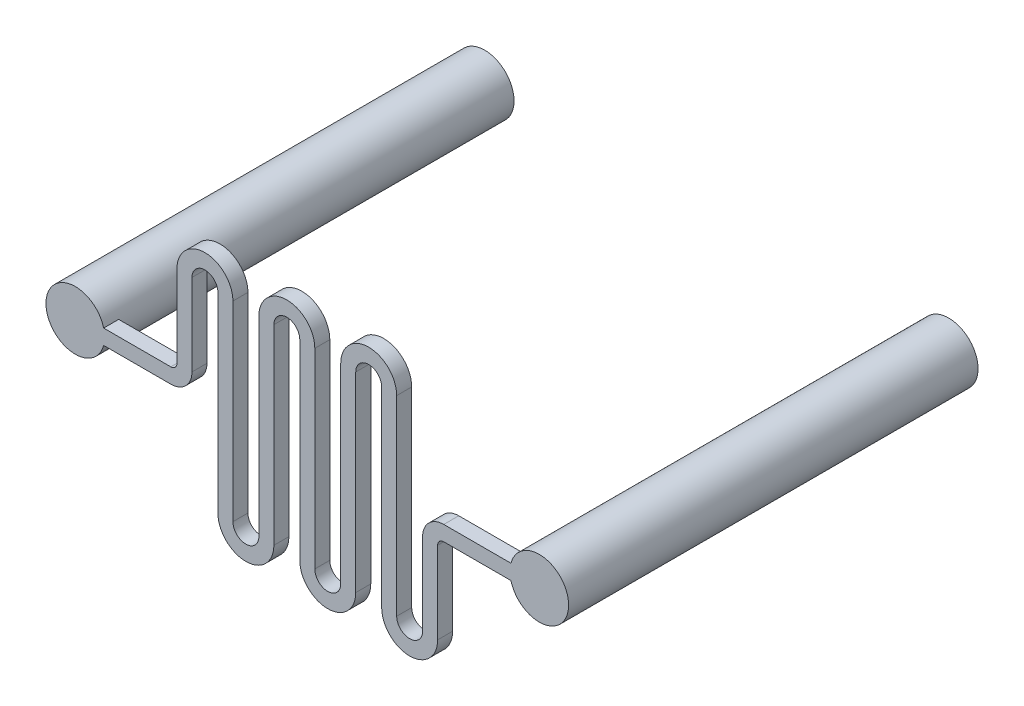
from build123d import *

# Parameters (mm, degrees)
BOSS_EXTRUDE1_DEPTH = 1.1
SKETCH3_W           = 2.15
SKETCH3_H           = 30
SKETCH4_W           = 2.15
SKETCH4_H           = 30
SKETCH5_R           = 1.5
CUT_EXTRUDE1_DEPTH  = 28


with BuildPart() as part:
    # Sketch2 → Boss-Extrude1 (new body)
    with BuildSketch(Plane.XY):
        with BuildLine():
            Line((-20.5, -0.55), (-13.5, -0.55))
            ThreePointArc((-13.5, -0.55), (-12.403984489, -0.096015511), (-11.95, 1))
            Line((-11.95, 1), (-11.95, 7))
            ThreePointArc((-11.95, 7), (-11, 7.95), (-10.05, 7))
            Line((-10.05, 7), (-10.05, 0))
            Line((-10.05, 0), (-10.05, -7))
            ThreePointArc((-10.05, -7), (-8, -9.05), (-5.95, -7))
            Line((-5.95, -7), (-5.95, 0))
            Line((-5.95, 0), (-5.95, 7))
            ThreePointArc((-5.95, 7), (-5, 7.95), (-4.05, 7))
            Line((-4.05, 7), (-4.05, 0))
            Line((-4.05, 0), (-4.05, -7))
            ThreePointArc((-4.05, -7), (-2, -9.05), (0.05, -7))
            Line((0.05, -7), (0.05, 0))
            Line((0.05, 0), (0.05, 7))
            ThreePointArc((0.05, 7), (1, 7.95), (1.95, 7))
            Line((1.95, 7), (1.95, 0))
            Line((1.95, 0), (1.95, -7))
            ThreePointArc((1.95, -7), (4, -9.05), (6.05, -7))
            Line((6.05, -7), (6.05, -1))
            ThreePointArc((6.05, -1), (6.181801948, -0.681801948), (6.5, -0.55))
            Line((6.5, -0.55), (13.5, -0.55))
            ThreePointArc((13.5, -0.55), (14.05, 0), (13.5, 0.55))
            Line((13.5, 0.55), (6.5, 0.55))
            ThreePointArc((6.5, 0.55), (5.403984489, 0.096015511), (4.95, -1))
            Line((4.95, -1), (4.95, -7))
            ThreePointArc((4.95, -7), (4, -7.95), (3.05, -7))
            Line((3.05, -7), (3.05, 0))
            Line((3.05, 0), (3.05, 7))
            ThreePointArc((3.05, 7), (1, 9.05), (-1.05, 7))
            Line((-1.05, 7), (-1.05, 0))
            Line((-1.05, 0), (-1.05, -7))
            ThreePointArc((-1.05, -7), (-2, -7.95), (-2.95, -7))
            Line((-2.95, -7), (-2.95, 0))
            Line((-2.95, 0), (-2.95, 7))
            ThreePointArc((-2.95, 7), (-5, 9.05), (-7.05, 7))
            Line((-7.05, 7), (-7.05, 0))
            Line((-7.05, 0), (-7.05, -7))
            ThreePointArc((-7.05, -7), (-8, -7.95), (-8.95, -7))
            Line((-8.95, -7), (-8.95, 0))
            Line((-8.95, 0), (-8.95, 7))
            ThreePointArc((-8.95, 7), (-11, 9.05), (-13.05, 7))
            Line((-13.05, 7), (-13.05, 1))
            ThreePointArc((-13.05, 1), (-13.181801948, 0.681801948), (-13.5, 0.55))
            Line((-13.5, 0.55), (-20.5, 0.55))
            ThreePointArc((-20.5, 0.55), (-21.05, 0), (-20.5, -0.55))
        make_face()
    extrude(amount=BOSS_EXTRUDE1_DEPTH)

    # Sketch3 → Revolve1 (revolve)
    with BuildSketch(Plane(origin=(0, 0, 0), x_dir=(-1, 0, 0), z_dir=(0, -1, 0)), mode=Mode.PRIVATE) as revolve1_sk:
        with Locations((21.575, 13.9)):
            Rectangle(SKETCH3_W, SKETCH3_H)
    revolve(revolve1_sk.sketch.rotate(Axis((-20.5, 0, 1.1), (0, 0, -1)), 180), axis=Axis((-20.5, 0, 1.1), (0, 0, -1)))

    # Sketch4 → Revolve2 (revolve)
    with BuildSketch(Plane(origin=(0, 0, 0), x_dir=(-1, 0, 0), z_dir=(0, -1, 0)), mode=Mode.PRIVATE) as revolve2_sk:
        with Locations((-14.575, 13.9)):
            Rectangle(SKETCH4_W, SKETCH4_H)
    revolve(revolve2_sk.sketch.rotate(Axis((13.5, 0, -28.9), (0, 0, 1)), 180), axis=Axis((13.5, 0, -28.9), (0, 0, 1)))

    # Sketch5 → Cut-Extrude1 (cut)
    with BuildSketch(Plane(origin=(0, 0, -28.9), x_dir=(-1, 0, 0), z_dir=(0, 0, -1))):
        with Locations((20.5, 0)):
            Circle(SKETCH5_R)
        with Locations((-13.5, 0)):
            Circle(SKETCH5_R)
    extrude(amount=-CUT_EXTRUDE1_DEPTH, mode=Mode.SUBTRACT)


solid = part.part
